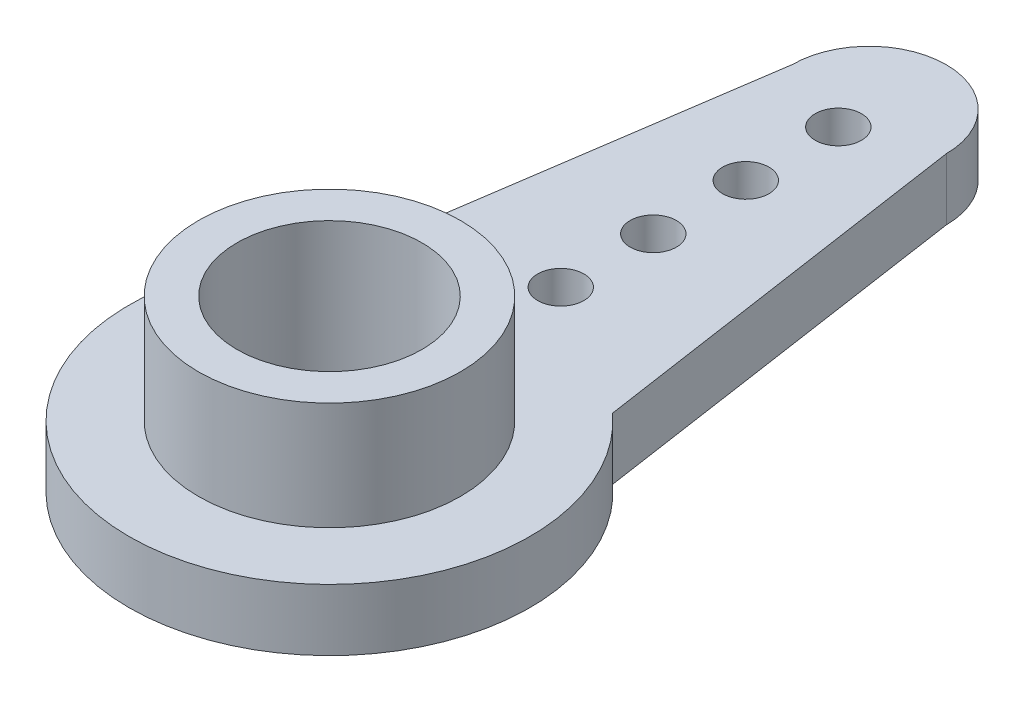
from build123d import *

# Parameters (mm, degrees)
AUFSATZ_LINEAR_AUSTRAGEN1_DEPTH = 2
SKIZZE2_R                       = 4.25
SKIZZE2_R_2                     = 3
AUFSATZ_LINEAR_AUSTRAGEN2_DEPTH = 3.5
SCHNITT_LINEAR_START            = -3.5
SKIZZE3_R                       = 3
SCHNITT_LINEAR_AUSTRAGEN1_DEPTH = 3.5
SKIZZE4_R                       = 0.75
SCHNITT_LINEAR_AUSTRAGEN2_DEPTH = 3.5


with BuildPart() as part:
    # Skizze1 → Aufsatz-Linear austragen1 (new body)
    with BuildSketch(Plane(origin=(0, 0, 0), x_dir=(1, 0, 0), z_dir=(0, 1, 0))):
        with BuildLine():
            Line((-2.5, 17.5), (-4.374965285, 4.807252725))
            ThreePointArc((-4.374965285, 4.807252725), (0, -6.5), (4.374965285, 4.807252725))
            Line((4.374965285, 4.807252725), (2.5, 17.5))
            ThreePointArc((2.5, 17.5), (0, 20), (-2.5, 17.5))
        make_face()
    extrude(amount=AUFSATZ_LINEAR_AUSTRAGEN1_DEPTH)

    # Skizze2 → Aufsatz-Linear austragen2 (add)
    with BuildSketch(Plane(origin=(0, 2, 0), x_dir=(1, 0, 0), z_dir=(0, 1, 0))):
        with Locations(Location((0, 0, 0), (0, 0, 270))):
            Circle(SKIZZE2_R)
        with Locations(Location((0, 0, 0), (0, 0, 270))):
            Circle(SKIZZE2_R_2, mode=Mode.SUBTRACT)
    extrude(amount=AUFSATZ_LINEAR_AUSTRAGEN2_DEPTH)

    # Skizze3 → Schnitt-Linear austragen1 (cut)
    with BuildSketch(Plane(origin=(0, 2, 0), x_dir=(1, 0, 0), z_dir=(0, 1, 0)).offset(SCHNITT_LINEAR_START)):
        with Locations(Location((0, 0, 0), (0, 0, 270))):
            Circle(SKIZZE3_R)
    extrude(amount=SCHNITT_LINEAR_AUSTRAGEN1_DEPTH, mode=Mode.SUBTRACT)

    # Skizze4 → Schnitt-Linear austragen2 (cut)
    with BuildSketch(Plane(origin=(0, 2, 0), x_dir=(1, 0, 0), z_dir=(0, 1, 0))):
        with Locations(Location((0, 7.5, 0), (0, 0, 270))):
            Circle(SKIZZE4_R)
        with Locations(Location((0, 10.5, 0), (0, 0, 270))):
            Circle(SKIZZE4_R)
        with Locations(Location((0, 13.5, 0), (0, 0, 270))):
            Circle(SKIZZE4_R)
        with Locations(Location((0, 16.5, 0), (0, 0, 270))):
            Circle(SKIZZE4_R)
    extrude(amount=-SCHNITT_LINEAR_AUSTRAGEN2_DEPTH, mode=Mode.SUBTRACT)


solid = part.part
